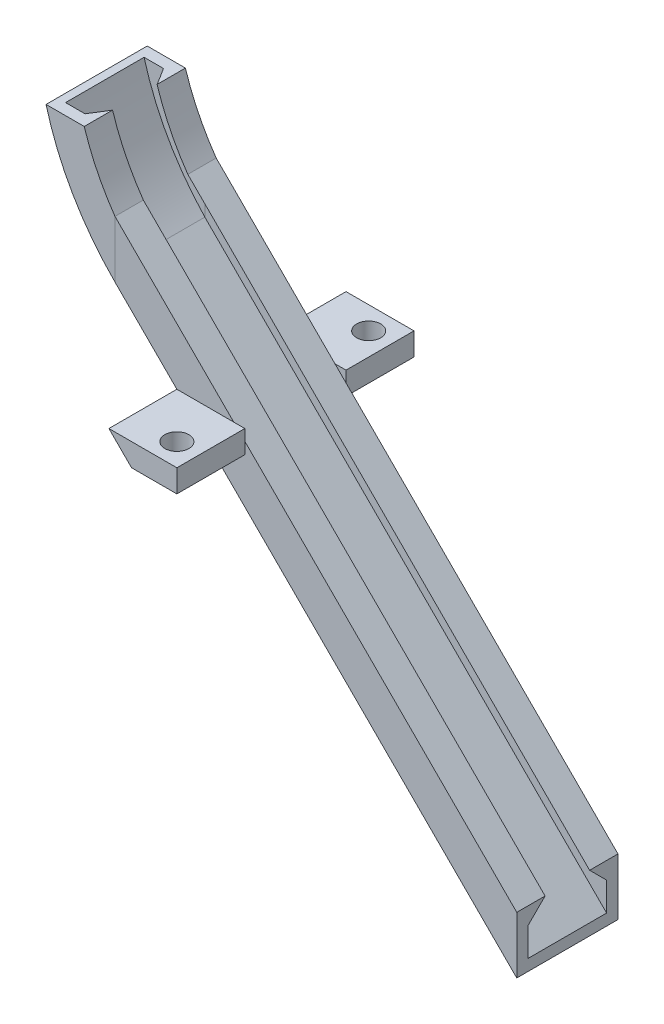
from build123d import *

# Parameters (mm, degrees)
CUT_EXTRUDE1_DEPTH      = 210.179727901
BOSS_EXTRUDE3_DEPTH     = 19.05
F_1_4_CLEARANCE_HOLE1_D = 6.7564


with BuildPart() as part:
    # Sweep1: sweep along a path in Sketch1
    with BuildLine(Plane.XY) as sweep1_path:
        Line((0, 0), (-112.58934785, 112.58934785))
        ThreePointArc((-112.58934785, 112.58934785), (-124.451195327, 128.04800845), (-131.907864376, 146.05))
    # Sketch2 → Sweep1 (sweep)
    with BuildSketch(Plane(origin=(0, 0, 0), x_dir=(0, 0, -1), z_dir=(1, 0, 0))):
        Polygon((0, 0), (14.175, 0), (14.175, 15.9375), (6.2375, 15.9375), (11, 11.175), (11, 3.175), (-11, 3.175), (-11, 11.175), (-6.2375, 15.9375), (-14.175, 15.9375), (-14.175, 0), align=None)
    sweep(path=sweep1_path.line)

    # Sketch3 → Cut-Extrude1 (cut, through all)
    with BuildSketch(Plane(origin=(0, 0, 14.175), x_dir=(-1, 0, 0), z_dir=(0, 0, -1))):
        Polygon((131.907864376, 146.05), (121.208421138, 146.05), (123.939114376, 159.852279873), align=None)
    extrude(amount=CUT_EXTRUDE1_DEPTH, mode=Mode.SUBTRACT)

    # Sketch10 → Boss-Extrude3 (add)
    with BuildSketch(Plane.XY.offset(14.175)):
        Polygon((-88.9, 88.9), (-95.25, 95.25), (-76.2, 95.25), (-76.2, 88.9), align=None)
    boss_extrude3 = extrude(amount=BOSS_EXTRUDE3_DEPTH)

    # 1/4 Clearance Hole1 (through all)
    with Locations(Plane(origin=(0, 95.25, 0), x_dir=(1, 0, 0), z_dir=(0, 1, 0))):
        with Locations((-82.55, -26.875)):
            f_1_4_clearance_hole1 = Hole(F_1_4_CLEARANCE_HOLE1_D / 2)

    # Mirror1: Boss-Extrude3, 1/4 Clearance Hole1 across plane
    add(boss_extrude3.mirror(Plane.XY))
    add(f_1_4_clearance_hole1.mirror(Plane.XY), mode=Mode.SUBTRACT)


solid = part.part
